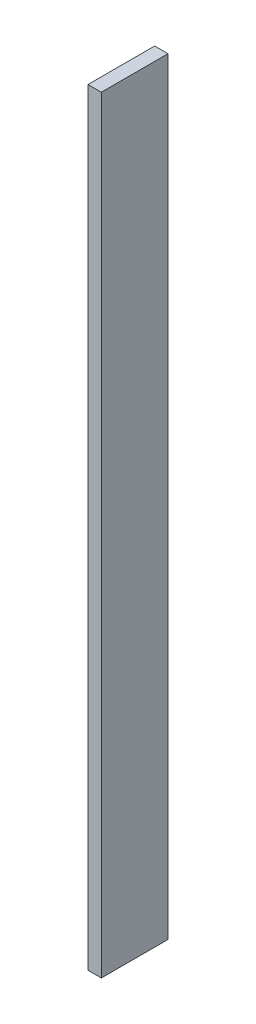
from build123d import *

# Parameters (mm, degrees)
SKETCH1_W           = 10.16
SKETCH1_H           = 50.8
BOSS_EXTRUDE1_DEPTH = 584.2


with BuildPart() as part:
    # Sketch1 → Boss-Extrude1 (new body)
    with BuildSketch(Plane(origin=(0, 0, 0), x_dir=(1, 0, 0), z_dir=(0, 1, 0))):
        with Locations((-4.891463918, 0.295993891)):
            Rectangle(SKETCH1_W, SKETCH1_H)
    extrude(amount=BOSS_EXTRUDE1_DEPTH)


solid = part.part
